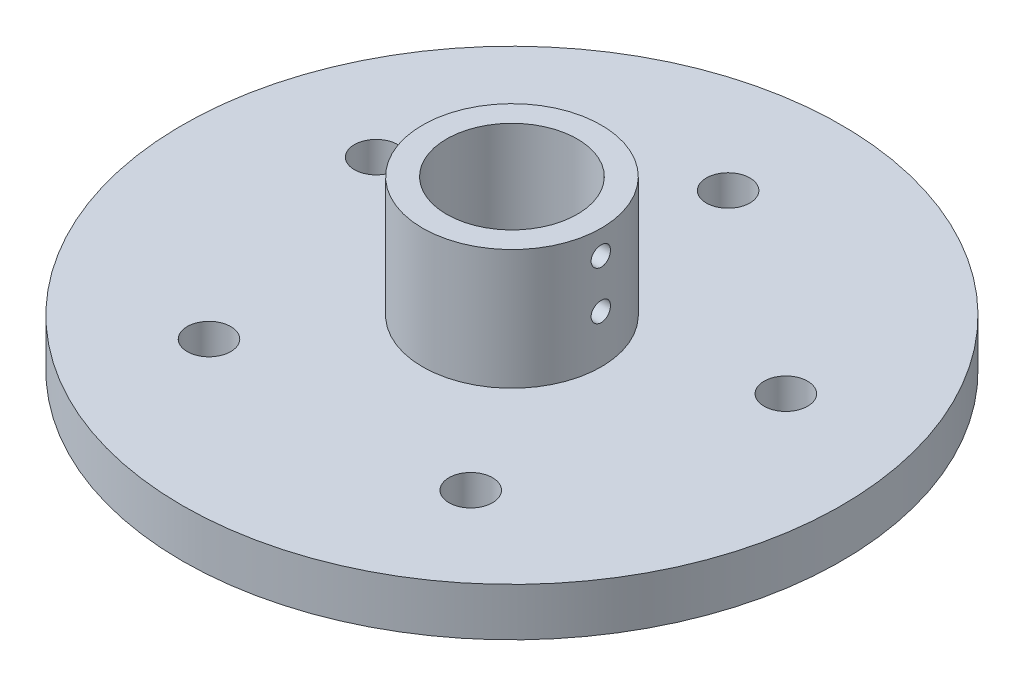
from build123d import *

# Parameters (mm, degrees)
SKETCH1_W                        = 6.35
SKETCH1_H                        = 31.75
SKETCH1_W_2                      = 69.85
SKETCH1_H_2                      = 12.7
F_1_2_20_TAPPED_HOLE1_D          = 11.50874
SKETCH7_W                        = 2.5527
SKETCH7_H                        = 87.122
F_1_4_20_TAPPED_HOLE1_AT_2_COUNT = 2
F_1_4_20_TAPPED_HOLE1_AT_2_PITCH = 12.7


with BuildPart() as part:
    # Sketch1 → Revolve1 (revolve)
    with BuildSketch(Plane.XY, mode=Mode.PRIVATE) as revolve1_sk:
        with Locations((20.447, 28.575)):
            Rectangle(SKETCH1_W, SKETCH1_H)
        with Locations((52.197, 6.35)):
            Rectangle(SKETCH1_W_2, SKETCH1_H_2)
    revolve(revolve1_sk.sketch.rotate(Axis((0, 7.809475806, 0), (0, -1, 0)), 90), axis=Axis((0, 7.809475806, 0), (0, -1, 0)))

    # 1/2-20 Tapped Hole1 (through all)
    with Locations(Plane(origin=(0, 12.7, 0), x_dir=(1, 0, 0), z_dir=(0, 1, 0))):
        with Locations((-54.155626078, 18.25625), (0, 57.15), (54.155626078, 18.25625), (34.599427772, -45.486284722), (-34.599427772, -45.486284722)):
            Hole(F_1_2_20_TAPPED_HOLE1_D / 2)

    # Sketch7 → 1/4-20 Tapped Hole1 (revolve, cut)
    with BuildSketch(Plane.ZX.offset(38.1)):
        with Locations((1.27635, 43.561)):
            Rectangle(SKETCH7_W, SKETCH7_H)
    f_1_4_20_tapped_hole1 = revolve(axis=Axis((-6.35, 38.1, 0), (1, 0, 0)), mode=Mode.SUBTRACT)

    # 1/4-20 Tapped Hole1 at 2: 1/4-20 Tapped Hole1 ×2
    with Locations(*[(0, -i * F_1_4_20_TAPPED_HOLE1_AT_2_PITCH, 0) for i in range(1, F_1_4_20_TAPPED_HOLE1_AT_2_COUNT)]):
        add(f_1_4_20_tapped_hole1, mode=Mode.SUBTRACT)


solid = part.part
